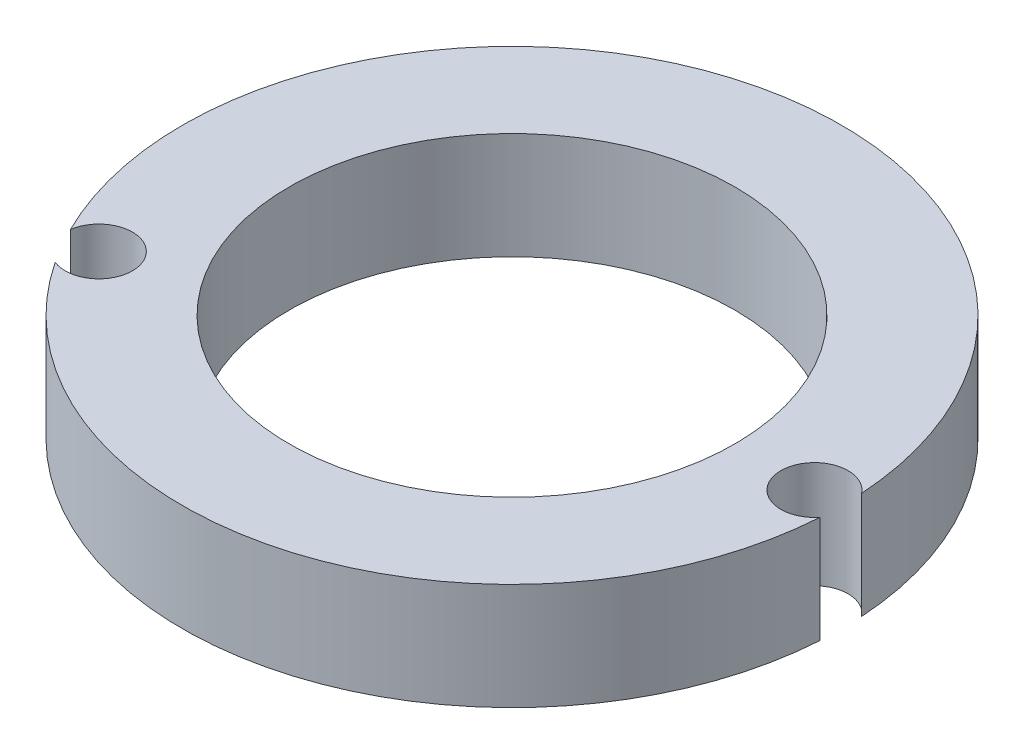
from build123d import *

# Parameters (mm, degrees)
SKETCH1_W          = 12.71
SKETCH1_H          = 12.7
SKETCH2_R          = 4
CUT_EXTRUDE3_DEPTH = 288.056150001


with BuildPart() as part:
    # Sketch1 → Revolve1 (revolve)
    with BuildSketch(Plane.XY, mode=Mode.PRIVATE) as revolve1_sk:
        with Locations((32.865, 275.296616264)):
            Rectangle(SKETCH1_W, SKETCH1_H)
    revolve(revolve1_sk.sketch.rotate(Axis((0, 0, 0), (0, 1, 0)), 90), axis=Axis((0, 0, 0), (0, 1, 0)))

    # Sketch2 → Cut-Extrude3 (cut, through all)
    with BuildSketch(Plane(origin=(0, 0, 0), x_dir=(1, 0, 0), z_dir=(0, 1, 0))):
        with Locations((-31.176914536, -18)):
            Circle(SKETCH2_R)
        with Locations((36, 0)):
            Circle(SKETCH2_R)
    extrude(amount=CUT_EXTRUDE3_DEPTH, mode=Mode.SUBTRACT)


solid = part.part
